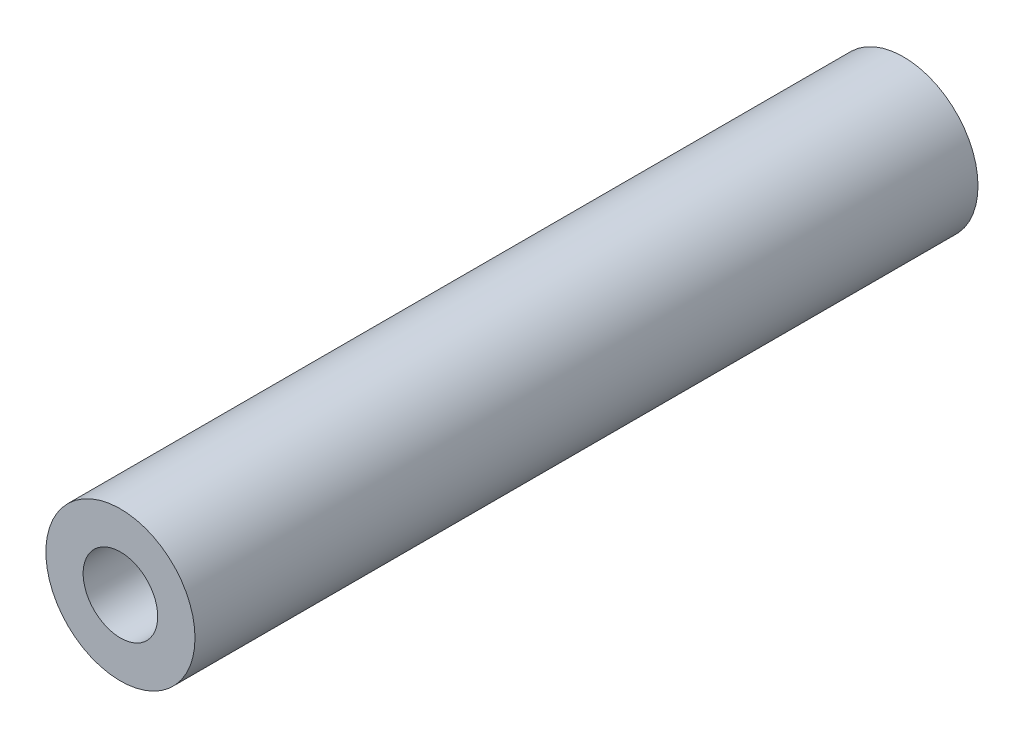
from build123d import *

# Parameters (mm, degrees)
SKETCH1_R           = 6.35
SKETCH1_R_2         = 3.175
BOSS_EXTRUDE1_DEPTH = 66.675


with BuildPart() as part:
    # Sketch1 → Boss-Extrude1 (new body)
    with BuildSketch(Plane.XY):
        Circle(SKETCH1_R)
        Circle(SKETCH1_R_2, mode=Mode.SUBTRACT)
    extrude(amount=BOSS_EXTRUDE1_DEPTH)


solid = part.part
